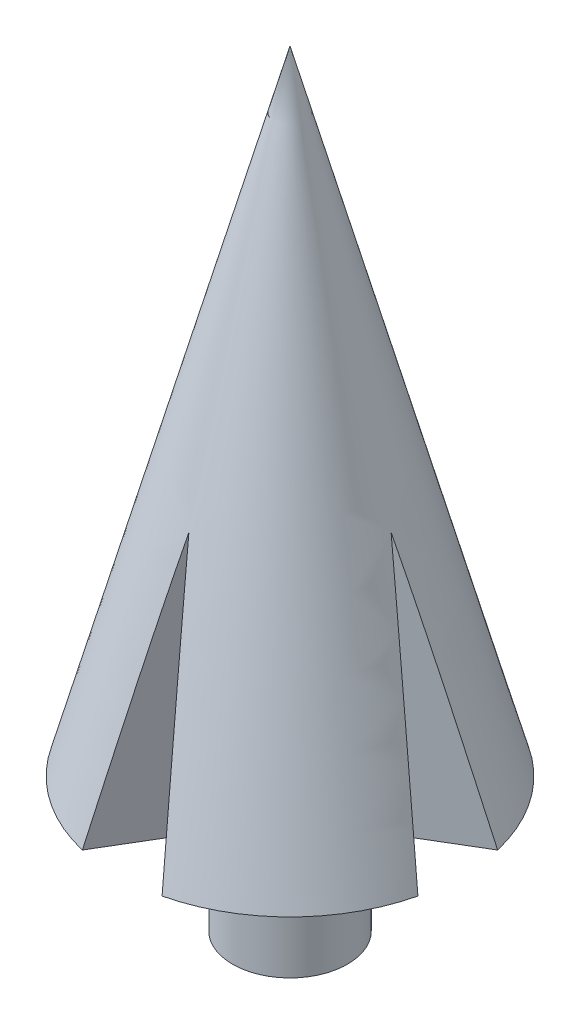
from build123d import *

# Parameters (mm, degrees)
CUT_EXTRUDE1_DEPTH = 15


with BuildPart() as part:
    # Sketch1 → Revolve1 (revolve)
    with BuildSketch(Plane.XY):
        Polygon((-3, 0), (-3, 7), (-9, 7), (0, 40), (0, 0), align=None)
    revolve(axis=Axis((0, 40, 0), (0, -1, 0)))

    # Sketch2 → Cut-Extrude1 (cut)
    with BuildSketch(Plane.XZ.offset(-7)):
        with BuildLine():
            Line((-2.079651877, 8.756428956), (0, 5.274248167))
            Line((0, 5.274248167), (2.079651877, 8.756428956))
            ThreePointArc((2.079651877, 8.756428956), (0, 9.330174076), (-2.079651877, 8.756428956))
        make_face()
        with BuildLine():
            Line((8.756428956, 2.079651877), (5.274248167, 0))
            Line((5.274248167, 0), (8.756428956, -2.079651877))
            ThreePointArc((8.756428956, -2.079651877), (9.330174076, 0), (8.756428956, 2.079651877))
        make_face()
        with BuildLine():
            Line((2.079651877, -8.756428956), (0, -5.274248167))
            Line((0, -5.274248167), (-2.079651877, -8.756428956))
            ThreePointArc((-2.079651877, -8.756428956), (0, -9.330174076), (2.079651877, -8.756428956))
        make_face()
        with BuildLine():
            Line((-8.756428956, -2.079651877), (-5.274248167, 0))
            Line((-5.274248167, 0), (-8.756428956, 2.079651877))
            ThreePointArc((-8.756428956, 2.079651877), (-9.330174076, 0), (-8.756428956, -2.079651877))
        make_face()
    extrude(amount=-CUT_EXTRUDE1_DEPTH, mode=Mode.SUBTRACT)


solid = part.part
